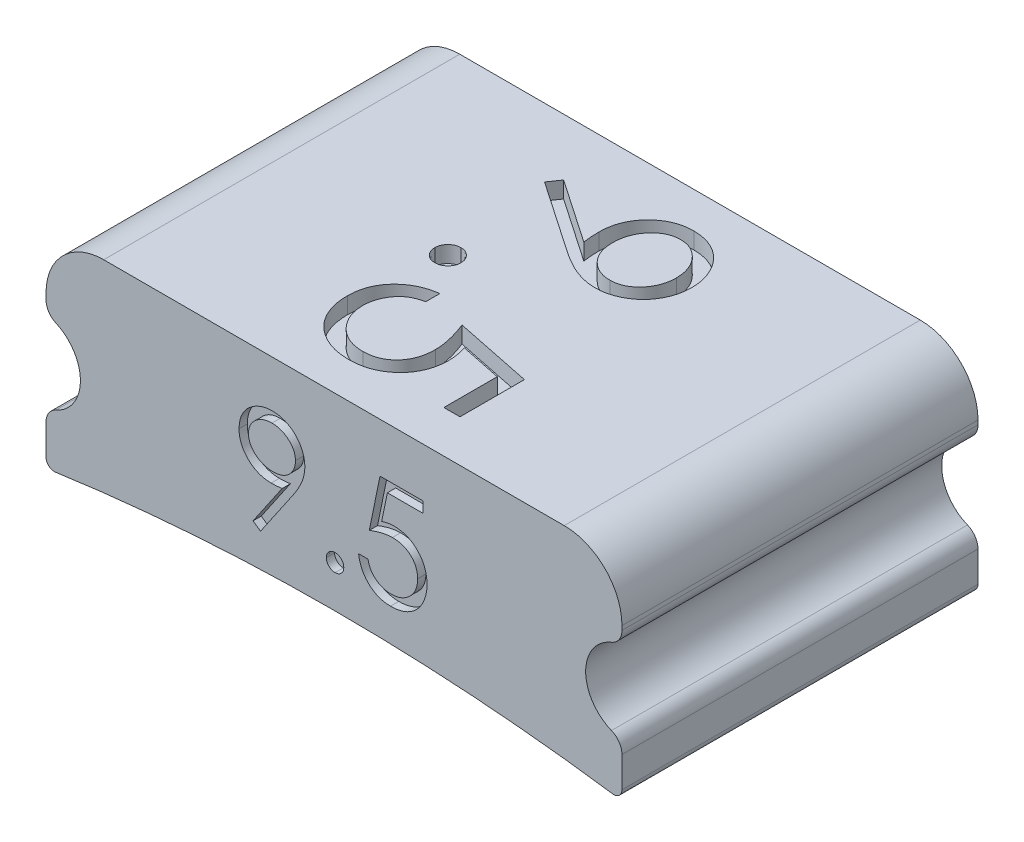
from build123d import *

# Parameters (mm, degrees)
BOSS_EXTRUDE2_DEPTH = 43.18
CUT_EXTRUDE1_DEPTH  = 1
CUT_EXTRUDE2_DEPTH  = 1
CUT_EXTRUDE3_DEPTH  = 2


with BuildPart() as part:
    # Sketch2 → Boss-Extrude2 (new body)
    with BuildSketch(Plane.XY):
        with BuildLine():
            Line((-27.925, 0), (27.925, 0))
            ThreePointArc((27.925, 0), (32.874747468, -2.050252532), (34.925, -7))
            Line((34.925, -7), (34.925, -7.500899585))
            ThreePointArc((34.925, -7.500899585), (34.577342263, -8.637568024), (33.653331555, -9.38528806))
            ThreePointArc((33.653331555, -9.38528806), (30.524226131, -14.022070726), (33.653331555, -18.658853391))
            ThreePointArc((33.653331555, -18.658853391), (34.577342263, -19.406573428), (34.925, -20.543241867))
            Line((34.925, -20.543241867), (34.925, -24.245870468))
            ThreePointArc((34.925, -24.245870468), (34.580739132, -25.000858011), (33.784987619, -25.236020221))
            ThreePointArc((33.784987619, -25.236020221), (0, -22.859155584), (-33.784987619, -25.236020221))
            ThreePointArc((-33.784987619, -25.236020221), (-34.580739132, -25.000858011), (-34.925, -24.245870468))
            Line((-34.925, -24.245870468), (-34.925, -20.543241867))
            ThreePointArc((-34.925, -20.543241867), (-34.597139349, -19.436474918), (-33.719357207, -18.686858887))
            ThreePointArc((-33.719357207, -18.686858887), (-30.752716475, -14.118987382), (-33.719357207, -9.551115877))
            ThreePointArc((-33.719357207, -9.551115877), (-34.597139349, -8.801499846), (-34.925, -7.694732898))
            Line((-34.925, -7.694732898), (-34.925, -7))
            ThreePointArc((-34.925, -7), (-32.874747468, -2.050252532), (-27.925, 0))
        make_face()
    extrude(amount=BOSS_EXTRUDE2_DEPTH)

    # Sketch3 → Cut-Extrude1 (cut)
    # profile 1 of 3: a face of its own
    with BuildSketch(Plane.XY.offset(43.18)):
        with BuildLine():
            Line((-8.906729726, -19.003539419), (-9.81750697, -18.370065861))
            Line((-9.81750697, -18.370065861), (-6.286337098, -13.208146791))
            add(Edge.make_bspline(
                [(-6.286337098, -13.208146791), (-6.511637767, -13.235698764), (-6.955267346, -13.289950134), (-7.402079116, -13.299916567), (-7.621974117, -13.30482147)],
                knots=[0, 0, 0, 0, 1.015715272, 2, 2, 2, 2], degree=3))
            add(Edge.make_bspline(
                [(-7.621974117, -13.30482147), (-7.755295262, -13.301406707), (-8.016993011, -13.294703826), (-8.401736436, -13.241574979), (-8.77143547, -13.159750229), (-9.12510999, -13.037653318), (-9.464089336, -12.88591296), (-9.787633496, -12.697746081), (-10.095306928, -12.476380395), (-10.383805244, -12.222986397), (-10.646193553, -11.944754607), (-10.879958091, -11.65027556), (-11.074235913, -11.336128466), (-11.23562238, -11.008721669), (-11.35801574, -10.663349339), (-11.447142662, -10.303941516), (-11.502015205, -9.927979272), (-11.508543351, -9.672073797), (-11.511857931, -9.542141182)],
                knots=[0, 0, 0, 0, 1.060718605, 2.082097864, 3.085795603, 4.069760067, 5.054557537, 6.03741023, 7.043284206, 8.066802108, 9.088538119, 10.083643548, 11.053783639, 12.022749082, 12.983451788, 13.964007469, 14.966251758, 16, 16, 16, 16], degree=3))
            add(Edge.make_bspline(
                [(-11.511857931, -9.542141182), (-11.505564411, -9.364454928), (-11.493211507, -9.015692856), (-11.39379403, -8.506118894), (-11.230289371, -8.024293436), (-11.002312118, -7.571483304), (-10.715166129, -7.154202164), (-10.370057816, -6.778250926), (-9.969086288, -6.448976742), (-9.521385819, -6.165933375), (-9.037504858, -5.938294956), (-8.530707156, -5.770512352), (-8.00487592, -5.671819752), (-7.648667517, -5.658808199), (-7.469329887, -5.652257368)],
                knots=[0, 0, 0, 0, 1.022988612, 2.007919123, 2.978103895, 3.94594894, 4.918897164, 5.887013414, 6.875921846, 7.89917871, 8.930658928, 9.948724884, 10.967259574, 12, 12, 12, 12], degree=3))
            add(Edge.make_bspline(
                [(-7.469329887, -5.652257368), (-7.293386193, -5.658898245), (-6.945738037, -5.672019993), (-6.434512213, -5.768118967), (-5.944869095, -5.930086322), (-5.479523, -6.153913168), (-5.048668561, -6.434477604), (-4.661224904, -6.768794305), (-4.326033662, -7.157071503), (-4.043644152, -7.58991831), (-3.816967148, -8.054981356), (-3.65341915, -8.540425875), (-3.552742117, -9.042760664), (-3.540055444, -9.383100613), (-3.533652803, -9.554861535)],
                knots=[0, 0, 0, 0, 1.026385292, 2.028040595, 3.023318987, 4.028184125, 5.03290303, 6.015178782, 7.004435299, 8.016004309, 9.023023918, 10.015172535, 10.998308025, 12, 12, 12, 12], degree=3))
            add(Edge.make_bspline(
                [(-3.533652803, -9.554861535), (-3.537928744, -9.688188918), (-3.546601421, -9.958610166), (-3.607330307, -10.369474553), (-3.710454979, -10.788397585), (-3.827482571, -11.142987376), (-3.940447865, -11.43584375), (-4.046769115, -11.667170912), (-4.164741786, -11.910652639), (-4.302332735, -12.163735837), (-4.45024164, -12.429646749), (-4.617371015, -12.705718318), (-4.799908376, -12.992321007), (-4.929919073, -13.18553187), (-4.996493348, -13.284468906)],
                knots=[0, 0, 0, 0, 1.179839688, 2.393009684, 3.667231171, 4.993948276, 5.694988576, 6.444077775, 7.246288328, 8.089075292, 8.993003841, 9.939041771, 10.944649915, 12, 12, 12, 12], degree=3))
            Line((-4.996493348, -13.284468906), (-8.906729726, -19.003539419))
        make_face()
        with BuildLine():
            add(Edge.make_bspline(
                [(-7.410816265, -12.002257368), (-7.309818556, -11.999498261), (-7.113210353, -11.994127218), (-6.825184154, -11.96143654), (-6.55331633, -11.903473791), (-6.296880654, -11.820307979), (-6.053305896, -11.71995378), (-5.826460933, -11.592184573), (-5.616155918, -11.439724212), (-5.420982582, -11.268419298), (-5.247667497, -11.078098609), (-5.093297072, -10.878900537), (-4.96208587, -10.669950666), (-4.858441979, -10.448632257), (-4.773226519, -10.220332672), (-4.714378304, -9.98137544), (-4.681778009, -9.733005529), (-4.67622058, -9.564281828), (-4.673396393, -9.478539419)],
                knots=[0, 0, 0, 0, 1.163407946, 2.26475976, 3.333800367, 4.359385343, 5.366239384, 6.363380779, 7.350133999, 8.353570782, 9.349036268, 10.310270964, 11.253520213, 12.184142, 13.120487599, 14.056272588, 15.012232024, 16, 16, 16, 16], degree=3))
            add(Edge.make_bspline(
                [(-4.673396393, -9.478539419), (-4.675826335, -9.392761205), (-4.680614835, -9.223724713), (-4.719031608, -8.974987086), (-4.786614561, -8.736614397), (-4.87729432, -8.507301637), (-4.996747754, -8.288932859), (-5.140088974, -8.078766467), (-5.31038672, -7.878135032), (-5.506338889, -7.691757148), (-5.717647124, -7.519951914), (-5.942838082, -7.368328153), (-6.180055634, -7.24125124), (-6.427852555, -7.136389264), (-6.686745135, -7.054558535), (-6.956580178, -6.995712669), (-7.238721221, -6.963158016), (-7.430241888, -6.957635714), (-7.527843508, -6.95482147)],
                knots=[0, 0, 0, 0, 0.972161553, 1.915763587, 2.844109794, 3.775983486, 4.705125789, 5.659731448, 6.655561913, 7.682237399, 8.721216875, 9.739758359, 10.754845918, 11.767244016, 12.7857855, 13.828538656, 14.893392813, 16, 16, 16, 16], degree=3))
            add(Edge.make_bspline(
                [(-7.527843508, -6.95482147), (-7.624596293, -6.95764026), (-7.814424461, -6.963170701), (-8.094057268, -6.995650788), (-8.362067791, -7.054954288), (-8.620210242, -7.13635136), (-8.867999799, -7.241259062), (-9.105206164, -7.368334811), (-9.330449796, -7.519917012), (-9.54155544, -7.691892329), (-9.737853614, -7.877267502), (-9.905223391, -8.079645373), (-10.048892656, -8.288823533), (-10.168181952, -8.507330691), (-10.258905372, -8.736606642), (-10.326476635, -8.974989186), (-10.364896549, -9.223724166), (-10.369684618, -9.392761021), (-10.372114342, -9.478539419)],
                knots=[0, 0, 0, 0, 1.099389452, 2.15699305, 3.192601482, 4.213358962, 5.227959689, 6.245255729, 7.266013209, 8.307253147, 9.336162325, 10.327954924, 11.284637477, 12.215801273, 13.149702402, 14.080068371, 15.025723358, 16, 16, 16, 16], degree=3))
            add(Edge.make_bspline(
                [(-10.372114342, -9.478539419), (-10.369915696, -9.564348597), (-10.365579563, -9.733580002), (-10.323750154, -9.982232914), (-10.253797539, -10.220587218), (-10.160110036, -10.450960526), (-10.036732838, -10.671112697), (-9.885334875, -10.879999982), (-9.707877608, -11.079990329), (-9.506733238, -11.267976498), (-9.286594483, -11.440522964), (-9.051474861, -11.591218921), (-8.805422025, -11.718481791), (-8.547569821, -11.820594813), (-8.279829148, -11.902642849), (-7.999793671, -11.961329713), (-7.708389495, -11.993813652), (-7.510958989, -11.999415793), (-7.410816265, -12.002257368)],
                knots=[0, 0, 0, 0, 0.952633368, 1.87876736, 2.791047057, 3.707742249, 4.635551637, 5.587206343, 6.568248508, 7.601284464, 8.641511608, 9.671105535, 10.699146789, 11.713763218, 12.747829548, 13.806491675, 14.887386225, 16, 16, 16, 16], degree=3))
        make_face(mode=Mode.SUBTRACT)
    # profile 2 of 3: a face of its own
    with BuildSketch(Plane.XY.offset(43.18)):
        with BuildLine():
            add(Edge.make_bspline(
                [(0.129807891, -16.719991364), (0.200529518, -16.724193854), (0.339171, -16.732432346), (0.539610123, -16.788953419), (0.721019317, -16.889314844), (0.882607748, -17.023074069), (1.01579982, -17.185255475), (1.119737897, -17.365217772), (1.175766615, -17.56733498), (1.183945095, -17.7067798), (1.188141224, -17.778324697)],
                knots=[0, 0, 0, 0, 1.020151414, 1.999887582, 2.974338812, 3.990962822, 5.007586832, 5.987933904, 6.967670073, 8, 8, 8, 8], degree=3))
            add(Edge.make_bspline(
                [(1.188141224, -17.778324697), (1.183802902, -17.848150494), (1.175247793, -17.985845939), (1.119866329, -18.186438675), (1.01500769, -18.366513443), (0.88352643, -18.530895487), (0.720979371, -18.664938074), (0.539181243, -18.764445639), (0.339641534, -18.825013681), (0.200608018, -18.832729102), (0.129807891, -18.83665803)],
                knots=[0, 0, 0, 0, 1.009421747, 1.99056486, 2.972319754, 3.999869655, 5.017953583, 5.993804169, 6.978383603, 8, 8, 8, 8], degree=3))
            add(Edge.make_bspline(
                [(0.129807891, -18.83665803), (0.058956748, -18.832871264), (-0.079363243, -18.825478503), (-0.278158137, -18.763202034), (-0.461063423, -18.665871193), (-0.623578834, -18.53064555), (-0.756161288, -18.367359315), (-0.856401963, -18.185198511), (-0.916600503, -17.986420152), (-0.924517584, -17.848263591), (-0.928525442, -17.778324697)],
                knots=[0, 0, 0, 0, 1.022052826, 1.995314843, 2.982371812, 4.00089066, 5.028879526, 6.005146991, 6.990147033, 8, 8, 8, 8], degree=3))
            add(Edge.make_bspline(
                [(-0.928525442, -17.778324697), (-0.924671539, -17.706662662), (-0.917147266, -17.566751334), (-0.856275585, -17.36645743), (-0.756939045, -17.184417665), (-0.622662326, -17.023321503), (-0.461102738, -16.888384719), (-0.278599365, -16.790178184), (-0.078884461, -16.731974402), (0.059037315, -16.724054984), (0.129807891, -16.719991364)],
                knots=[0, 0, 0, 0, 1.032775665, 2.016367738, 2.991239715, 4.008302682, 5.025365648, 6.011011707, 6.979408107, 8, 8, 8, 8], degree=3))
        make_face()
    # profile 3 of 3: a face of its own
    with BuildSketch(Plane.XY.offset(43.18)):
        with BuildLine():
            Line((10.794551073, -5.971874761), (10.794551073, -7.274438864))
            Line((10.794551073, -7.274438864), (6.474719342, -7.274438864))
            Line((6.474719342, -7.274438864), (5.790364374, -10.614803447))
            add(Edge.make_bspline(
                [(5.790364374, -10.614803447), (5.924824261, -10.577682175), (6.185319026, -10.505765582), (6.56980195, -10.425916072), (6.934807946, -10.37778146), (7.17166429, -10.371208991), (7.286277836, -10.368028607)],
                knots=[0, 0, 0, 0, 1.100273476, 2.13160584, 3.095893838, 4, 4, 4, 4], degree=3))
            add(Edge.make_bspline(
                [(7.286277836, -10.368028607), (7.428095977, -10.371098145), (7.706945876, -10.377133624), (8.114938626, -10.435088621), (8.504403696, -10.526310597), (8.874526582, -10.653747918), (9.225992009, -10.816706093), (9.555566303, -11.020268734), (9.868196445, -11.258061107), (10.158273857, -11.531455864), (10.42143349, -11.832342874), (10.652812938, -12.155858577), (10.849345765, -12.498858951), (11.007409076, -12.86462116), (11.133626517, -13.249101517), (11.217635184, -13.656345459), (11.273575814, -14.082514352), (11.279825616, -14.37390522), (11.283012611, -14.522495755)],
                knots=[0, 0, 0, 0, 1.052922333, 2.070308379, 3.05430497, 4.020497103, 4.973039431, 5.925935799, 6.892292201, 7.88610001, 8.88166317, 9.857072816, 10.836096531, 11.812156883, 12.81219415, 13.836441305, 14.89672472, 16, 16, 16, 16], degree=3))
            add(Edge.make_bspline(
                [(11.283012611, -14.522495755), (11.280599338, -14.625990668), (11.275805405, -14.831581852), (11.25142653, -15.136905094), (11.20448836, -15.435764517), (11.141468333, -15.728199768), (11.059671559, -16.013657204), (10.960651278, -16.292953891), (10.839471407, -16.564351464), (10.706551845, -16.830417897), (10.556886053, -17.085138195), (10.390775469, -17.323350232), (10.21527783, -17.548627482), (10.026441946, -17.758553884), (9.82251262, -17.951749978), (9.605959598, -18.129362314), (9.378510874, -18.294394569), (9.136647567, -18.440147735), (8.885759128, -18.574270461), (8.622222455, -18.684301582), (8.352036485, -18.78267407), (8.071312507, -18.861085785), (7.780686387, -18.922526768), (7.479679059, -18.964257519), (7.169869199, -18.99465202), (6.959865582, -18.996554687), (6.853785849, -18.997515787)],
                knots=[0, 0, 0, 0, 1.056347294, 2.098418968, 3.122841568, 4.141288669, 5.149314143, 6.15115421, 7.162517403, 8.180376062, 9.185164535, 10.17417709, 11.141909838, 12.097768115, 13.052685741, 14.0056014, 14.954263652, 15.917497458, 16.885230207, 17.854509472, 18.828990115, 19.81800267, 20.826176721, 21.857883937, 22.917946725, 24, 24, 24, 24], degree=3))
            add(Edge.make_bspline(
                [(6.853785849, -18.997515787), (6.727242393, -18.995009032), (6.478283093, -18.990077287), (6.113537035, -18.938484498), (5.76260118, -18.864592573), (5.428300528, -18.753426679), (5.107639085, -18.614135639), (4.804933795, -18.438091245), (4.512449979, -18.23859564), (4.242077731, -18.003172645), (3.991139834, -17.745850027), (3.766507644, -17.466603729), (3.566451523, -17.170042611), (3.394175127, -16.854726452), (3.247225164, -16.521483782), (3.131782206, -16.169066036), (3.038606461, -15.799314593), (2.999187764, -15.54475757), (2.979166458, -15.415464505)],
                knots=[0, 0, 0, 0, 1.0467383, 2.05933395, 3.04377827, 4.011590433, 4.970194871, 5.932262533, 6.905835911, 7.896367577, 8.894135286, 9.877477877, 10.858688626, 11.851381753, 12.8477658, 13.868841284, 14.917554742, 16, 16, 16, 16], degree=3))
            Line((2.979166458, -15.415464505), (4.118910047, -15.415464505))
            add(Edge.make_bspline(
                [(4.118910047, -15.415464505), (4.14695367, -15.536573346), (4.20085507, -15.769351265), (4.319167358, -16.096399275), (4.463823535, -16.387843315), (4.635833599, -16.64753866), (4.841029424, -16.873994164), (5.075179066, -17.075804646), (5.337697947, -17.257868687), (5.629410523, -17.409625585), (5.937160839, -17.539052205), (6.259259001, -17.625236926), (6.586934773, -17.685837309), (6.808562002, -17.691903412), (6.919931682, -17.694951684)],
                knots=[0, 0, 0, 0, 1.136247022, 2.183929868, 3.172523383, 4.106158343, 5.02341133, 5.958108904, 6.928429099, 7.938127109, 8.96079061, 9.975095812, 10.982467395, 12, 12, 12, 12], degree=3))
            add(Edge.make_bspline(
                [(6.919931682, -17.694951684), (7.028638037, -17.691973433), (7.242681741, -17.686109232), (7.557683058, -17.640973388), (7.861804059, -17.571458772), (8.152043896, -17.467428155), (8.433481483, -17.340991606), (8.698997735, -17.178739759), (8.95627389, -16.992013406), (9.197313117, -16.778085063), (9.418073404, -16.542337885), (9.61313133, -16.290234201), (9.775607558, -16.021295929), (9.912528468, -15.74017906), (10.016499009, -15.443802581), (10.090670569, -15.13355546), (10.134224526, -14.808671389), (10.14021595, -14.587077036), (10.143269022, -14.474158415)],
                knots=[0, 0, 0, 0, 1.027316725, 2.022795036, 3.002884548, 3.971462791, 4.93288096, 5.914575861, 6.907176829, 7.935150275, 8.956128384, 9.956726525, 10.942570165, 11.921478529, 12.907843606, 13.90538589, 14.932640048, 16, 16, 16, 16], degree=3))
            add(Edge.make_bspline(
                [(10.143269022, -14.474158415), (10.140879682, -14.372283545), (10.136202889, -14.172877982), (10.097991963, -13.881143718), (10.03152752, -13.60510725), (9.939275156, -13.343435601), (9.822146656, -13.095881968), (9.679012895, -12.862190864), (9.507187708, -12.645442383), (9.310911426, -12.445535117), (9.095889392, -12.261040857), (8.858422097, -12.103763743), (8.603478934, -11.971451813), (8.334131531, -11.857267934), (8.043973184, -11.775259515), (7.738749975, -11.71369033), (7.415165921, -11.678074586), (7.193929424, -11.673132876), (7.080208124, -11.67059271)],
                knots=[0, 0, 0, 0, 1.045622112, 2.046656509, 3.013763289, 3.955457236, 4.890082067, 5.820317437, 6.762574623, 7.722996705, 8.69280354, 9.665887285, 10.63943826, 11.638615906, 12.663482002, 13.728887084, 14.832589034, 16, 16, 16, 16], degree=3))
            add(Edge.make_bspline(
                [(7.080208124, -11.67059271), (6.981768868, -11.672699426), (6.778516779, -11.677049261), (6.466739665, -11.709076835), (6.139109699, -11.760745132), (5.796882815, -11.83181523), (5.439031257, -11.924819423), (5.066310203, -12.036269183), (4.677935978, -12.169517578), (4.416251664, -12.270145896), (4.28173056, -12.321874761)],
                knots=[0, 0, 0, 0, 0.817624296, 1.688186739, 2.600797293, 3.572016777, 4.590301741, 5.671205678, 6.80286297, 8, 8, 8, 8], degree=3))
            Line((4.28173056, -12.321874761), (5.584294663, -5.971874761))
            Line((5.584294663, -5.971874761), (10.794551073, -5.971874761))
        make_face()
    extrude(amount=-CUT_EXTRUDE1_DEPTH, mode=Mode.SUBTRACT)

    # Sketch4 → Cut-Extrude2 (cut)
    # profile 1 of 3: a face of its own
    with BuildSketch(Plane(origin=(0, 0, 0), x_dir=(-1, 0, 0), z_dir=(0, 0, -1))):
        with BuildLine():
            Line((-8.840704075, -18.993454911), (-9.751481319, -18.359981353))
            Line((-9.751481319, -18.359981353), (-6.220311447, -13.198062283))
            add(Edge.make_bspline(
                [(-6.220311447, -13.198062283), (-6.445612116, -13.225614255), (-6.889241695, -13.279865625), (-7.336053465, -13.289832058), (-7.555948466, -13.294736962)],
                knots=[0, 0, 0, 0, 1.015715272, 2, 2, 2, 2], degree=3))
            add(Edge.make_bspline(
                [(-7.555948466, -13.294736962), (-7.689269611, -13.291322199), (-7.95096736, -13.284619317), (-8.335710785, -13.23149047), (-8.705409819, -13.149665721), (-9.059084339, -13.02756881), (-9.398063685, -12.875828451), (-9.721607845, -12.687661573), (-10.029281276, -12.466295886), (-10.317779592, -12.212901889), (-10.580167902, -11.934670098), (-10.81393244, -11.640191051), (-11.008210261, -11.326043958), (-11.169596728, -10.998637161), (-11.291990088, -10.653264831), (-11.381117011, -10.293857007), (-11.435989554, -9.917894763), (-11.4425177, -9.661989289), (-11.44583228, -9.532056674)],
                knots=[0, 0, 0, 0, 1.060718605, 2.082097864, 3.085795603, 4.069760067, 5.054557537, 6.03741023, 7.043284206, 8.066802108, 9.088538119, 10.083643548, 11.053783639, 12.022749082, 12.983451788, 13.964007469, 14.966251758, 16, 16, 16, 16], degree=3))
            add(Edge.make_bspline(
                [(-11.44583228, -9.532056674), (-11.43953876, -9.354370419), (-11.427185856, -9.005608348), (-11.327768379, -8.496034386), (-11.164263719, -8.014208928), (-10.936286467, -7.561398795), (-10.649140477, -7.144117656), (-10.304032165, -6.768166417), (-9.903060637, -6.438892233), (-9.455360168, -6.155848867), (-8.971479206, -5.928210448), (-8.464681504, -5.760427843), (-7.938850269, -5.661735244), (-7.582641866, -5.648723691), (-7.403304235, -5.642172859)],
                knots=[0, 0, 0, 0, 1.022988612, 2.007919123, 2.978103895, 3.94594894, 4.918897164, 5.887013414, 6.875921846, 7.89917871, 8.930658928, 9.948724884, 10.967259574, 12, 12, 12, 12], degree=3))
            add(Edge.make_bspline(
                [(-7.403304235, -5.642172859), (-7.227360541, -5.648813737), (-6.879712386, -5.661935485), (-6.368486562, -5.758034458), (-5.878843443, -5.920001814), (-5.413497349, -6.143828659), (-4.98264291, -6.424393096), (-4.595199252, -6.758709796), (-4.26000801, -7.146986995), (-3.9776185, -7.579833802), (-3.750941497, -8.044896848), (-3.587393499, -8.530341367), (-3.486716466, -9.032676155), (-3.474029793, -9.373016104), (-3.467627152, -9.544777026)],
                knots=[0, 0, 0, 0, 1.026385292, 2.028040595, 3.023318987, 4.028184125, 5.03290303, 6.015178782, 7.004435299, 8.016004309, 9.023023918, 10.015172535, 10.998308025, 12, 12, 12, 12], degree=3))
            add(Edge.make_bspline(
                [(-3.467627152, -9.544777026), (-3.471903093, -9.67810441), (-3.48057577, -9.948525657), (-3.541304655, -10.359390044), (-3.644429327, -10.778313077), (-3.76145692, -11.132902867), (-3.874422214, -11.425759242), (-3.980743463, -11.657086404), (-4.098716135, -11.900568131), (-4.236307084, -12.153651328), (-4.384215989, -12.419562241), (-4.551345364, -12.695633809), (-4.733882724, -12.982236499), (-4.863893422, -13.175447361), (-4.930467697, -13.274384398)],
                knots=[0, 0, 0, 0, 1.179839688, 2.393009684, 3.667231171, 4.993948276, 5.694988576, 6.444077775, 7.246288328, 8.089075292, 8.993003841, 9.939041771, 10.944649915, 12, 12, 12, 12], degree=3))
            Line((-4.930467697, -13.274384398), (-8.840704075, -18.993454911))
        make_face()
        with BuildLine():
            add(Edge.make_bspline(
                [(-7.344790614, -11.992172859), (-7.243792905, -11.989413753), (-7.047184702, -11.98404271), (-6.759158503, -11.951352032), (-6.487290679, -11.893389282), (-6.230855003, -11.81022347), (-5.987280245, -11.709869271), (-5.760435282, -11.582100065), (-5.550130266, -11.429639704), (-5.354956931, -11.25833479), (-5.181641846, -11.068014101), (-5.027271421, -10.868816028), (-4.896060219, -10.659866158), (-4.792416328, -10.438547749), (-4.707200868, -10.210248164), (-4.648352653, -9.971290932), (-4.615752358, -9.722921021), (-4.610194929, -9.554197319), (-4.607370742, -9.468454911)],
                knots=[0, 0, 0, 0, 1.163407946, 2.26475976, 3.333800367, 4.359385343, 5.366239384, 6.363380779, 7.350133999, 8.353570782, 9.349036268, 10.310270964, 11.253520213, 12.184142, 13.120487599, 14.056272588, 15.012232024, 16, 16, 16, 16], degree=3))
            add(Edge.make_bspline(
                [(-4.607370742, -9.468454911), (-4.609800684, -9.382676697), (-4.614589184, -9.213640205), (-4.653005957, -8.964902577), (-4.72058891, -8.726529888), (-4.811268668, -8.497217128), (-4.930722103, -8.27884835), (-5.074063322, -8.068681958), (-5.244361069, -7.868050523), (-5.440313237, -7.68167264), (-5.651621473, -7.509867406), (-5.876812431, -7.358243644), (-6.114029983, -7.231166732), (-6.361826903, -7.126304755), (-6.620719484, -7.044474026), (-6.890554527, -6.98562816), (-7.17269557, -6.953073508), (-7.364216236, -6.947551205), (-7.461817857, -6.944736962)],
                knots=[0, 0, 0, 0, 0.972161553, 1.915763587, 2.844109794, 3.775983486, 4.705125789, 5.659731448, 6.655561913, 7.682237399, 8.721216875, 9.739758359, 10.754845918, 11.767244016, 12.7857855, 13.828538656, 14.893392813, 16, 16, 16, 16], degree=3))
            add(Edge.make_bspline(
                [(-7.461817857, -6.944736962), (-7.558570642, -6.947555751), (-7.74839881, -6.953086193), (-8.028031617, -6.98556628), (-8.29604214, -7.04486978), (-8.554184591, -7.126266851), (-8.801974148, -7.231174554), (-9.039180512, -7.358250303), (-9.264424144, -7.509832503), (-9.475529788, -7.681807821), (-9.671827963, -7.867182994), (-9.839197739, -8.069560864), (-9.982867005, -8.278739025), (-10.102156301, -8.497246183), (-10.192879721, -8.726522134), (-10.260450984, -8.964904678), (-10.298870898, -9.213639658), (-10.303658967, -9.382676513), (-10.30608869, -9.468454911)],
                knots=[0, 0, 0, 0, 1.099389452, 2.15699305, 3.192601482, 4.213358962, 5.227959689, 6.245255729, 7.266013209, 8.307253147, 9.336162325, 10.327954924, 11.284637477, 12.215801273, 13.149702402, 14.080068371, 15.025723358, 16, 16, 16, 16], degree=3))
            add(Edge.make_bspline(
                [(-10.30608869, -9.468454911), (-10.303890044, -9.554264089), (-10.299553912, -9.723495494), (-10.257724503, -9.972148405), (-10.187771888, -10.210502709), (-10.094084385, -10.440876017), (-9.970707186, -10.661028188), (-9.819309224, -10.869915473), (-9.641851957, -11.069905821), (-9.440707587, -11.25789199), (-9.220568832, -11.430438455), (-8.98544921, -11.581134413), (-8.739396373, -11.708397283), (-8.48154417, -11.810510304), (-8.213803496, -11.89255834), (-7.93376802, -11.951245205), (-7.642363844, -11.983729144), (-7.444933338, -11.989331284), (-7.344790614, -11.992172859)],
                knots=[0, 0, 0, 0, 0.952633368, 1.87876736, 2.791047057, 3.707742249, 4.635551637, 5.587206343, 6.568248508, 7.601284464, 8.641511608, 9.671105535, 10.699146789, 11.713763218, 12.747829548, 13.806491675, 14.887386225, 16, 16, 16, 16], degree=3))
        make_face(mode=Mode.SUBTRACT)
    # profile 2 of 3: a face of its own
    with BuildSketch(Plane(origin=(0, 0, 0), x_dir=(-1, 0, 0), z_dir=(0, 0, -1))):
        with BuildLine():
            add(Edge.make_bspline(
                [(0.195833542, -16.718028607), (0.266555169, -16.722231098), (0.405196651, -16.730469589), (0.605635774, -16.786990662), (0.787044968, -16.887352088), (0.948633399, -17.021111312), (1.081825471, -17.183292718), (1.185763549, -17.363255016), (1.241792266, -17.565372223), (1.249970746, -17.704817044), (1.254166876, -17.77636194)],
                knots=[0, 0, 0, 0, 1.020151414, 1.999887582, 2.974338812, 3.990962822, 5.007586832, 5.987933904, 6.967670073, 8, 8, 8, 8], degree=3))
            add(Edge.make_bspline(
                [(1.254166876, -17.77636194), (1.249828553, -17.846187737), (1.241273444, -17.983883182), (1.185891981, -18.184475918), (1.081033341, -18.364550686), (0.949552081, -18.52893273), (0.787005022, -18.662975318), (0.605206894, -18.762482883), (0.405667186, -18.823050924), (0.266633669, -18.830766345), (0.195833542, -18.834695274)],
                knots=[0, 0, 0, 0, 1.009421747, 1.99056486, 2.972319754, 3.999869655, 5.017953583, 5.993804169, 6.978383603, 8, 8, 8, 8], degree=3))
            add(Edge.make_bspline(
                [(0.195833542, -18.834695274), (0.124982399, -18.830908507), (-0.013337592, -18.823515746), (-0.212132486, -18.761239278), (-0.395037771, -18.663908436), (-0.557553183, -18.528682793), (-0.690135637, -18.365396558), (-0.790376312, -18.183235754), (-0.850574852, -17.984457396), (-0.858491933, -17.846300834), (-0.862499791, -17.77636194)],
                knots=[0, 0, 0, 0, 1.022052826, 1.995314843, 2.982371812, 4.00089066, 5.028879526, 6.005146991, 6.990147033, 8, 8, 8, 8], degree=3))
            add(Edge.make_bspline(
                [(-0.862499791, -17.77636194), (-0.858645888, -17.704699906), (-0.851121615, -17.564788578), (-0.790249934, -17.364494673), (-0.690913393, -17.182454908), (-0.556636674, -17.021358746), (-0.395077087, -16.886421962), (-0.212573713, -16.788215427), (-0.01285881, -16.730011646), (0.125062966, -16.722092228), (0.195833542, -16.718028607)],
                knots=[0, 0, 0, 0, 1.032775665, 2.016367738, 2.991239715, 4.008302682, 5.025365648, 6.011011707, 6.979408107, 8, 8, 8, 8], degree=3))
        make_face()
    # profile 3 of 3: a face of its own
    with BuildSketch(Plane(origin=(0, 0, 0), x_dir=(-1, 0, 0), z_dir=(0, 0, -1))):
        with BuildLine():
            Line((10.860576724, -5.973837518), (10.860576724, -7.27640162))
            Line((10.860576724, -7.27640162), (6.540744993, -7.27640162))
            Line((6.540744993, -7.27640162), (5.856390026, -10.616766204))
            add(Edge.make_bspline(
                [(5.856390026, -10.616766204), (5.990849913, -10.579644932), (6.251344677, -10.507728338), (6.635827601, -10.427878828), (7.000833597, -10.379744217), (7.237689941, -10.373171747), (7.352303487, -10.369991364)],
                knots=[0, 0, 0, 0, 1.100273476, 2.13160584, 3.095893838, 4, 4, 4, 4], degree=3))
            add(Edge.make_bspline(
                [(7.352303487, -10.369991364), (7.494121628, -10.373060902), (7.772971527, -10.379096381), (8.180964278, -10.437051377), (8.570429347, -10.528273353), (8.940552233, -10.655710675), (9.29201766, -10.81866885), (9.621591955, -11.02223149), (9.934222096, -11.260023863), (10.224299508, -11.533418621), (10.487459141, -11.83430563), (10.718838589, -12.157821334), (10.915371417, -12.500821708), (11.073434727, -12.866583917), (11.199652169, -13.251064274), (11.283660836, -13.658308216), (11.339601465, -14.084477109), (11.345851267, -14.375867977), (11.349038263, -14.524458511)],
                knots=[0, 0, 0, 0, 1.052922333, 2.070308379, 3.05430497, 4.020497103, 4.973039431, 5.925935799, 6.892292201, 7.88610001, 8.88166317, 9.857072816, 10.836096531, 11.812156883, 12.81219415, 13.836441305, 14.89672472, 16, 16, 16, 16], degree=3))
            add(Edge.make_bspline(
                [(11.349038263, -14.524458511), (11.34662499, -14.627953425), (11.341831057, -14.833544609), (11.317452181, -15.138867851), (11.270514012, -15.437727274), (11.207493984, -15.730162524), (11.12569721, -16.015619961), (11.026676929, -16.294916648), (10.905497058, -16.566314221), (10.772577496, -16.832380654), (10.622911705, -17.087100952), (10.456801121, -17.325312988), (10.281303481, -17.550590238), (10.092467597, -17.760516641), (9.888538272, -17.953712735), (9.671985249, -18.13132507), (9.444536526, -18.296357326), (9.202673218, -18.442110491), (8.95178478, -18.576233218), (8.688248106, -18.686264339), (8.418062136, -18.784636827), (8.137338159, -18.863048541), (7.846712039, -18.924489525), (7.54570471, -18.966220275), (7.235894851, -18.996614777), (7.025891234, -18.998517444), (6.9198115, -18.999478543)],
                knots=[0, 0, 0, 0, 1.056347294, 2.098418968, 3.122841568, 4.141288669, 5.149314143, 6.15115421, 7.162517403, 8.180376062, 9.185164535, 10.17417709, 11.141909838, 12.097768115, 13.052685741, 14.0056014, 14.954263652, 15.917497458, 16.885230207, 17.854509472, 18.828990115, 19.81800267, 20.826176721, 21.857883937, 22.917946725, 24, 24, 24, 24], degree=3))
            add(Edge.make_bspline(
                [(6.9198115, -18.999478543), (6.793268044, -18.996971788), (6.544308744, -18.992040044), (6.179562687, -18.940447255), (5.828626832, -18.86655533), (5.494326179, -18.755389436), (5.173664736, -18.616098395), (4.870959446, -18.440054002), (4.57847563, -18.240558397), (4.308103382, -18.005135402), (4.057165485, -17.747812784), (3.832533296, -17.468566486), (3.632477174, -17.172005368), (3.460200778, -16.856689208), (3.313250815, -16.523446539), (3.197807858, -16.171028793), (3.104632112, -15.80127735), (3.065213415, -15.546720327), (3.045192109, -15.417427261)],
                knots=[0, 0, 0, 0, 1.0467383, 2.05933395, 3.04377827, 4.011590433, 4.970194871, 5.932262533, 6.905835911, 7.896367577, 8.894135286, 9.877477877, 10.858688626, 11.851381753, 12.8477658, 13.868841284, 14.917554742, 16, 16, 16, 16], degree=3))
            Line((3.045192109, -15.417427261), (4.184935699, -15.417427261))
            add(Edge.make_bspline(
                [(4.184935699, -15.417427261), (4.212979321, -15.538536103), (4.266880721, -15.771314022), (4.385193009, -16.098362032), (4.529849186, -16.389806072), (4.70185925, -16.649501417), (4.907055075, -16.875956921), (5.141204717, -17.077767403), (5.403723598, -17.259831444), (5.695436174, -17.411588342), (6.003186491, -17.541014961), (6.325284653, -17.627199683), (6.652960424, -17.687800066), (6.874587653, -17.693866169), (6.985957333, -17.696914441)],
                knots=[0, 0, 0, 0, 1.136247022, 2.183929868, 3.172523383, 4.106158343, 5.02341133, 5.958108904, 6.928429099, 7.938127109, 8.96079061, 9.975095812, 10.982467395, 12, 12, 12, 12], degree=3))
            add(Edge.make_bspline(
                [(6.985957333, -17.696914441), (7.094663689, -17.693936189), (7.308707392, -17.688071988), (7.623708709, -17.642936145), (7.92782971, -17.573421529), (8.218069548, -17.469390912), (8.499507134, -17.342954362), (8.765023387, -17.180702516), (9.022299541, -16.993976163), (9.263338768, -16.78004782), (9.484099056, -16.544300642), (9.679156981, -16.292196957), (9.84163321, -16.023258686), (9.978554119, -15.742141817), (10.08252466, -15.445765338), (10.156696221, -15.135518217), (10.200250177, -14.810634146), (10.206241601, -14.589039793), (10.209294673, -14.476121172)],
                knots=[0, 0, 0, 0, 1.027316725, 2.022795036, 3.002884548, 3.971462791, 4.93288096, 5.914575861, 6.907176829, 7.935150275, 8.956128384, 9.956726525, 10.942570165, 11.921478529, 12.907843606, 13.90538589, 14.932640048, 16, 16, 16, 16], degree=3))
            add(Edge.make_bspline(
                [(10.209294673, -14.476121172), (10.206905333, -14.374246301), (10.202228541, -14.174840738), (10.164017614, -13.883106475), (10.097553171, -13.607070007), (10.005300807, -13.345398358), (9.888172308, -13.097844724), (9.745038546, -12.86415362), (9.573213359, -12.64740514), (9.376937078, -12.447497874), (9.161915043, -12.263003613), (8.924447749, -12.1057265), (8.669504586, -11.97341457), (8.400157182, -11.85923069), (8.109998836, -11.777222271), (7.804775627, -11.715653087), (7.481191572, -11.680037342), (7.259955075, -11.675095633), (7.146233776, -11.672555466)],
                knots=[0, 0, 0, 0, 1.045622112, 2.046656509, 3.013763289, 3.955457236, 4.890082067, 5.820317437, 6.762574623, 7.722996705, 8.69280354, 9.665887285, 10.63943826, 11.638615906, 12.663482002, 13.728887084, 14.832589034, 16, 16, 16, 16], degree=3))
            add(Edge.make_bspline(
                [(7.146233776, -11.672555466), (7.04779452, -11.674662183), (6.84454243, -11.679012018), (6.532765316, -11.711039592), (6.20513535, -11.762707889), (5.862908466, -11.833777987), (5.505056908, -11.92678218), (5.132335854, -12.038231939), (4.743961629, -12.171480335), (4.482277315, -12.272108653), (4.347756211, -12.323837518)],
                knots=[0, 0, 0, 0, 0.817624296, 1.688186739, 2.600797293, 3.572016777, 4.590301741, 5.671205678, 6.80286297, 8, 8, 8, 8], degree=3))
            Line((4.347756211, -12.323837518), (5.650320314, -5.973837518))
            Line((5.650320314, -5.973837518), (10.860576724, -5.973837518))
        make_face()
    extrude(amount=-CUT_EXTRUDE2_DEPTH, mode=Mode.SUBTRACT)

    # Sketch5 → Cut-Extrude3 (cut)
    # profile 1 of 3: a face of its own
    with BuildSketch(Plane(origin=(0, 0, 0), x_dir=(1, 0, 0), z_dir=(0, 1, 0))):
        with BuildLine():
            Line((-9.363461538, -8.279423077), (-8.413251202, -6.913257212))
            Line((-8.413251202, -6.913257212), (-0.670372596, -12.210012019))
            add(Edge.make_bspline(
                [(-0.670372596, -12.210012019), (-0.711700555, -11.872061015), (-0.79307761, -11.206616647), (-0.80802726, -10.536398992), (-0.815384615, -10.20655649)],
                knots=[0, 0, 0, 0, 1.015715272, 2, 2, 2, 2], degree=3))
            add(Edge.make_bspline(
                [(-0.815384615, -10.20655649), (-0.81024728, -10.006580305), (-0.800163141, -9.61404454), (-0.720685906, -9.036850729), (-0.596890821, -8.481414605), (-0.416451023, -7.949851836), (-0.185844223, -7.442635956), (0.095064945, -6.957997004), (0.427322111, -6.496576702), (0.80735583, -6.063804562), (1.224718846, -5.6702287), (1.666433436, -5.319580179), (2.137655107, -5.02816389), (2.628765029, -4.786084072), (3.146823597, -4.602494064), (3.685935313, -4.468803672), (4.249878684, -4.38649486), (4.633736895, -4.376702639), (4.828635817, -4.371730769)],
                knots=[0, 0, 0, 0, 1.060702494, 2.082066239, 3.085748733, 4.076089625, 5.054723785, 6.037561548, 7.043420247, 8.066922603, 9.088643095, 10.08373341, 11.053858765, 12.022809492, 12.983497605, 13.964038393, 14.966267459, 16, 16, 16, 16], degree=3))
            add(Edge.make_bspline(
                [(4.828635817, -4.371730769), (5.095165199, -4.38117105), (5.618308306, -4.399700406), (6.382669249, -4.548826621), (7.105407436, -4.794083611), (7.784622635, -5.13604949), (8.410544344, -5.566768474), (8.974471202, -6.084430943), (9.468382478, -6.685888234), (9.892947528, -7.357438938), (10.234405156, -8.08326038), (10.486079063, -8.843456933), (10.634117962, -9.632203787), (10.653635292, -10.166516391), (10.663461538, -10.435522837)],
                knots=[0, 0, 0, 0, 1.022988612, 2.007919123, 2.978103895, 3.94594894, 4.918897164, 5.887013414, 6.875921846, 7.89917871, 8.930658928, 9.948724884, 10.967259574, 12, 12, 12, 12], degree=3))
            add(Edge.make_bspline(
                [(10.663461538, -10.435522837), (10.653536018, -10.699448662), (10.633924125, -11.220941218), (10.489031154, -11.988822749), (10.24743168, -12.724939406), (9.912022547, -13.423499551), (9.4888701, -14.066947434), (8.988807031, -14.647780933), (8.406198755, -15.150439447), (7.756981321, -15.574058905), (7.059372611, -15.91406498), (6.33120955, -16.159389456), (5.577706398, -16.31040436), (5.067196606, -16.329434456), (4.809555288, -16.339038462)],
                knots=[0, 0, 0, 0, 1.026337322, 2.02794581, 3.027878252, 4.032696425, 5.033228651, 6.015458494, 7.004668777, 8.016190509, 9.023163053, 10.0152653, 10.998354841, 12, 12, 12, 12], degree=3))
            add(Edge.make_bspline(
                [(4.809555288, -16.339038462), (4.609548202, -16.332703773), (4.203883857, -16.319855442), (3.588133846, -16.227554025), (2.959001433, -16.078061128), (2.425800254, -15.904655742), (1.98988852, -15.727088134), (1.640058328, -15.574314533), (1.274983145, -15.396497745), (0.897346129, -15.185277448), (0.497211684, -14.964454287), (0.083318268, -14.713374271), (-0.346646977, -14.439678657), (-0.636454636, -14.244647034), (-0.784855769, -14.144777644)],
                knots=[0, 0, 0, 0, 1.179688711, 2.392703466, 3.66501481, 4.991562144, 5.695278944, 6.441221078, 7.243328977, 8.089575748, 8.993388627, 9.939305498, 10.944784961, 12, 12, 12, 12], degree=3))
            Line((-0.784855769, -14.144777644), (-9.363461538, -8.279423077))
        make_face()
        with BuildLine():
            add(Edge.make_bspline(
                [(1.138461538, -10.523293269), (1.142600199, -10.674789832), (1.150656763, -10.969702136), (1.19969278, -11.401741435), (1.286636904, -11.809543171), (1.411385623, -12.194196685), (1.561916921, -12.559558823), (1.75357073, -12.899826266), (1.982261272, -13.21528379), (2.239218643, -13.508043793), (2.524699676, -13.76801642), (2.823496785, -13.999572059), (3.136921591, -14.196388861), (3.468899204, -14.351854698), (3.811348582, -14.479677887), (4.16978443, -14.56795021), (4.542339296, -14.616850653), (4.795424849, -14.625186796), (4.924038462, -14.629423077)],
                knots=[0, 0, 0, 0, 1.163407946, 2.26475976, 3.333800367, 4.359385343, 5.366239384, 6.363380779, 7.350133999, 8.353570782, 9.349036268, 10.310270964, 11.253520213, 12.184142, 13.120487599, 14.056272588, 15.012232024, 16, 16, 16, 16], degree=3))
            add(Edge.make_bspline(
                [(4.924038462, -14.629423077), (5.052706063, -14.625778494), (5.306261355, -14.618596397), (5.679363757, -14.560966481), (6.036937826, -14.459609754), (6.380850809, -14.323523999), (6.708615091, -14.144592407), (7.022368594, -13.92907939), (7.325989462, -13.678060611), (7.603840796, -13.383473008), (7.863273535, -13.066524791), (8.088174162, -12.725734873), (8.280151658, -12.369556514), (8.437214984, -11.997705908), (8.560023205, -11.609409033), (8.648274893, -11.204644903), (8.69711154, -10.781436494), (8.705394349, -10.494155057), (8.709615385, -10.347752404)],
                knots=[0, 0, 0, 0, 0.972051712, 1.915547132, 2.843788449, 3.775556853, 4.704594175, 5.659091977, 6.648619647, 7.675179132, 8.714041218, 9.74046568, 10.755438548, 11.767722258, 12.786148662, 13.828784001, 14.893517844, 16, 16, 16, 16], degree=3))
            add(Edge.make_bspline(
                [(8.709615385, -10.347752404), (8.705388299, -10.202622639), (8.697094793, -9.917879235), (8.648359075, -9.49843836), (8.559461116, -9.096391935), (8.437155676, -8.709290481), (8.281005965, -8.338223656), (8.088175617, -7.984878511), (7.862072237, -7.647639744), (7.604171155, -7.330781922), (7.32465555, -7.03682596), (7.023695237, -6.78138646), (6.70844898, -6.566372829), (6.380894955, -6.387193141), (6.036926043, -6.25117338), (5.679366949, -6.149798984), (5.306260524, -6.092173815), (5.052705783, -6.084991067), (4.924038462, -6.081346154)],
                knots=[0, 0, 0, 0, 1.099545523, 2.15729926, 3.193054709, 4.213957097, 5.228701859, 6.237665598, 7.258567987, 8.299955741, 9.329010984, 10.327149711, 11.283968076, 12.215264062, 13.149297769, 14.079795814, 15.025585048, 16, 16, 16, 16], degree=3))
            add(Edge.make_bspline(
                [(4.924038462, -6.081346154), (4.795324694, -6.084644123), (4.541477587, -6.091148322), (4.16849822, -6.153892435), (3.810966764, -6.258821358), (3.465406802, -6.399352612), (3.135178545, -6.58441841), (2.821847618, -6.811515354), (2.521862096, -7.077701255), (2.239882843, -7.379417809), (1.981063145, -7.709625942), (1.755019209, -8.062305374), (1.564124904, -8.43138463), (1.410955371, -8.818162934), (1.287883317, -9.219773945), (1.199853021, -9.63982716), (1.151127112, -10.076933424), (1.142723901, -10.373079182), (1.138461538, -10.523293269)],
                knots=[0, 0, 0, 0, 0.952633368, 1.87876736, 2.791047057, 3.707742249, 4.635551637, 5.587206343, 6.568248508, 7.601284464, 8.641511608, 9.671105535, 10.699146789, 11.713763218, 12.747829548, 13.806491675, 14.887386225, 16, 16, 16, 16], degree=3))
        make_face(mode=Mode.SUBTRACT)
    # profile 2 of 3: a face of its own
    with BuildSketch(Plane(origin=(0, 0, 0), x_dir=(1, 0, 0), z_dir=(0, 1, 0))):
        with BuildLine():
            add(Edge.make_bspline(
                [(-5.944230769, -21.834230769), (-5.9503262, -21.940386633), (-5.962205327, -22.147269298), (-6.049510999, -22.446841653), (-6.196820802, -22.720596713), (-6.399225978, -22.962936095), (-6.640870221, -23.164351173), (-6.913929869, -23.313355983), (-7.214370725, -23.404663506), (-7.424237717, -23.415949915), (-7.531730769, -23.421730769)],
                knots=[0, 0, 0, 0, 1.020591893, 1.988988293, 2.974634352, 3.991697318, 5.008760285, 5.983632262, 6.967224335, 8, 8, 8, 8], degree=3))
            add(Edge.make_bspline(
                [(-7.531730769, -23.421730769), (-7.63663911, -23.415718982), (-7.843873952, -23.403843361), (-8.14204149, -23.31354555), (-8.415282696, -23.163184538), (-8.660212048, -22.964310857), (-8.863050513, -22.72053774), (-9.009046775, -22.446179811), (-9.102461478, -22.147987471), (-9.113550619, -21.940507484), (-9.119230769, -21.834230769)],
                knots=[0, 0, 0, 0, 1.009852967, 1.994853009, 2.971120474, 3.99910934, 5.017628188, 6.004685157, 6.977947174, 8, 8, 8, 8], degree=3))
            add(Edge.make_bspline(
                [(-9.119230769, -21.834230769), (-9.113337376, -21.728030579), (-9.101764245, -21.519480304), (-9.010912183, -21.220170742), (-8.861650835, -20.947473549), (-8.660586953, -20.703652961), (-8.414013887, -20.506431071), (-8.143901736, -20.349143112), (-7.843012632, -20.266070916), (-7.636469464, -20.253238253), (-7.531730769, -20.246730769)],
                knots=[0, 0, 0, 0, 1.021616397, 2.006195831, 2.982046417, 4.000130345, 5.027680246, 6.00943514, 6.990578253, 8, 8, 8, 8], degree=3))
            add(Edge.make_bspline(
                [(-7.531730769, -20.246730769), (-7.424413424, -20.253024963), (-7.215246193, -20.265292683), (-6.912070382, -20.34933576), (-6.642126936, -20.505242877), (-6.398854826, -20.705030984), (-6.19821599, -20.947413631), (-6.047673852, -21.219527422), (-5.962892242, -21.520186106), (-5.950534505, -21.728148329), (-5.944230769, -21.834230769)],
                knots=[0, 0, 0, 0, 1.032329927, 2.012066096, 2.992413168, 4.009037178, 5.025661188, 6.000112418, 6.979848586, 8, 8, 8, 8], degree=3))
        make_face()
    # profile 3 of 3: a face of its own
    with BuildSketch(Plane(origin=(0, 0, 0), x_dir=(1, 0, 0), z_dir=(0, 1, 0))):
        with BuildLine():
            Line((10.175, -38.075576923), (8.221153846, -38.075576923))
            Line((8.221153846, -38.075576923), (8.221153846, -31.595829327))
            Line((8.221153846, -31.595829327), (3.210606971, -30.569296875))
            add(Edge.make_bspline(
                [(3.210606971, -30.569296875), (3.266288879, -30.770986706), (3.374163769, -31.161728853), (3.493938034, -31.738453239), (3.566139951, -32.285962232), (3.575998655, -32.641246748), (3.580769231, -32.813167067)],
                knots=[0, 0, 0, 0, 1.100273476, 2.13160584, 3.095893838, 4, 4, 4, 4], degree=3))
            add(Edge.make_bspline(
                [(3.580769231, -32.813167067), (3.576163718, -33.025893545), (3.567108131, -33.44416695), (3.480192762, -34.056166508), (3.343297608, -34.64032623), (3.152367344, -35.195648054), (2.906642642, -35.723328085), (2.603669225, -36.220419514), (2.245542731, -36.689739541), (1.835718475, -37.125083936), (1.384119374, -37.519415796), (0.900146211, -37.867493757), (0.383358763, -38.156982287), (-0.163957767, -38.395148845), (-0.740885051, -38.58411101), (-1.351693489, -38.7102252), (-1.990962722, -38.794108162), (-2.428046816, -38.803486754), (-2.65093149, -38.808269231)],
                knots=[0, 0, 0, 0, 1.052772836, 2.070014431, 3.053871312, 4.019926262, 4.972333346, 5.930471369, 6.896690565, 7.89035727, 8.885779078, 9.861050232, 10.836829716, 11.812751485, 12.812646763, 13.836748493, 14.896881366, 16, 16, 16, 16], degree=3))
            add(Edge.make_bspline(
                [(-2.65093149, -38.808269231), (-2.806174065, -38.804649809), (-3.114561245, -38.797459878), (-3.572543123, -38.760884417), (-4.020843364, -38.690503755), (-4.459455253, -38.595875579), (-4.887792403, -38.473541949), (-5.30569901, -38.323839955), (-5.714461881, -38.14737821), (-6.114107789, -37.948148717), (-6.492316285, -37.717677119), (-6.854925587, -37.474902187), (-7.188590909, -37.205974386), (-7.505493259, -36.923913865), (-7.793187384, -36.617442184), (-8.063984962, -36.296071736), (-8.306123101, -35.952260756), (-8.528835525, -35.592164739), (-8.72824358, -35.216010758), (-8.894585516, -34.81998469), (-9.04038566, -34.412780342), (-9.15895111, -33.990768342), (-9.250940762, -33.554766258), (-9.313584467, -33.103272684), (-9.359163214, -32.638553133), (-9.362018991, -32.323548358), (-9.363461538, -32.164429087)],
                knots=[0, 0, 0, 0, 1.05623316, 2.098192244, 3.122504159, 4.140841222, 5.148757784, 6.150489607, 7.158294732, 8.176043417, 9.185147859, 10.169157858, 11.142149047, 12.097904048, 13.0527185, 13.998867679, 14.954465986, 15.910220987, 16.877849176, 17.847023716, 18.829548819, 19.818454515, 20.826519638, 21.858115382, 22.918063636, 24, 24, 24, 24], degree=3))
            add(Edge.make_bspline(
                [(-9.363461538, -32.164429087), (-9.359701077, -31.974614135), (-9.352302812, -31.601175643), (-9.274918324, -31.054053244), (-9.164063288, -30.527661557), (-8.997376926, -30.026166508), (-8.788209807, -29.545336973), (-8.525532464, -29.091573712), (-8.223704241, -28.655957799), (-7.87231105, -28.250328763), (-7.484632899, -27.874619959), (-7.068436938, -27.533133293), (-6.622068306, -27.233651531), (-6.149327097, -26.974952512), (-5.649399882, -26.75460472), (-5.120790698, -26.581419003), (-4.566158756, -26.441661217), (-4.184323879, -26.382532368), (-3.990384615, -26.3525)],
                knots=[0, 0, 0, 0, 1.046825758, 2.059506013, 3.044032586, 4.011925612, 4.970610144, 5.93275819, 6.900651216, 7.891265644, 8.889116719, 9.876966323, 10.858259055, 11.851035124, 12.847502422, 13.86866322, 14.9174643, 16, 16, 16, 16], degree=3))
            Line((-3.990384615, -26.3525), (-3.990384615, -28.062115385))
            add(Edge.make_bspline(
                [(-3.990384615, -28.062115385), (-4.172065211, -28.104154344), (-4.521265402, -28.184955559), (-5.011606762, -28.362776301), (-5.450212272, -28.578854613), (-5.837496005, -28.841640377), (-6.176991452, -29.148773161), (-6.482142429, -29.496728219), (-6.753791287, -29.890462624), (-6.981681407, -30.327820384), (-7.17575144, -30.789503774), (-7.30504713, -31.272635599), (-7.395942843, -31.764153284), (-7.40504265, -32.096593588), (-7.409615385, -32.263647837)],
                knots=[0, 0, 0, 0, 1.136389429, 2.184203582, 3.172920998, 4.111012962, 5.028380909, 5.957351669, 6.927793475, 7.937618031, 8.960409703, 9.974842029, 10.982339866, 12, 12, 12, 12], degree=3))
            add(Edge.make_bspline(
                [(-7.409615385, -32.263647837), (-7.405148008, -32.42670737), (-7.396351706, -32.747772925), (-7.32864794, -33.220274901), (-7.224376016, -33.676456402), (-7.068330091, -34.111816158), (-6.878675267, -34.533972538), (-6.635297497, -34.932246917), (-6.355207968, -35.318161148), (-6.034315453, -35.679719989), (-5.680694687, -36.01086042), (-5.30253916, -36.303447308), (-4.899131752, -36.547161651), (-4.477456449, -36.752543015), (-4.03289173, -36.908498827), (-3.567521048, -37.019756168), (-3.080194942, -37.085087102), (-2.747803413, -37.094074239), (-2.578425481, -37.098653846)],
                knots=[0, 0, 0, 0, 1.027316725, 2.022795036, 3.002884548, 3.971462791, 4.93288096, 5.914575861, 6.907176829, 7.935150275, 8.956128384, 9.956726525, 10.942570165, 11.921478529, 12.907843606, 13.90538589, 14.932640048, 16, 16, 16, 16], degree=3))
            add(Edge.make_bspline(
                [(-2.578425481, -37.098653846), (-2.425521098, -37.095647104), (-2.126061007, -37.08975846), (-1.689874965, -37.024321177), (-1.274164265, -36.932653697), (-0.882646477, -36.791909976), (-0.509588385, -36.618009164), (-0.162974797, -36.397382488), (0.16609939, -36.145183471), (0.464265678, -35.849788666), (0.741316688, -35.527673187), (0.977148869, -35.171359645), (1.175639288, -34.788975279), (1.346908887, -34.384945783), (1.469923252, -33.949710606), (1.562276538, -33.491875132), (1.615700292, -33.006499234), (1.623112837, -32.674644463), (1.626923077, -32.5040625)],
                knots=[0, 0, 0, 0, 1.045726679, 2.048034203, 3.01323695, 3.95502507, 4.889743367, 5.8246644, 6.761650845, 7.722168973, 8.692072792, 9.66525385, 10.638902184, 11.638179751, 12.663148338, 13.728659964, 14.832472288, 16, 16, 16, 16], degree=3))
            add(Edge.make_bspline(
                [(1.626923077, -32.5040625), (1.62387031, -32.355121311), (1.617620824, -32.050215575), (1.568438659, -31.581423527), (1.49277663, -31.090937188), (1.383723501, -30.576852337), (1.247181474, -30.040579789), (1.076657602, -29.481227716), (0.880235607, -28.898782604), (0.727884016, -28.506755337), (0.65, -28.306346154)],
                knots=[0, 0, 0, 0, 0.824638674, 1.688163388, 2.607705698, 3.571998603, 4.597075385, 5.671199175, 6.809488238, 8, 8, 8, 8], degree=3))
            Line((0.65, -28.306346154), (10.175, -30.260192308))
            Line((10.175, -30.260192308), (10.175, -38.075576923))
        make_face()
    extrude(amount=-CUT_EXTRUDE3_DEPTH, mode=Mode.SUBTRACT)


solid = part.part
